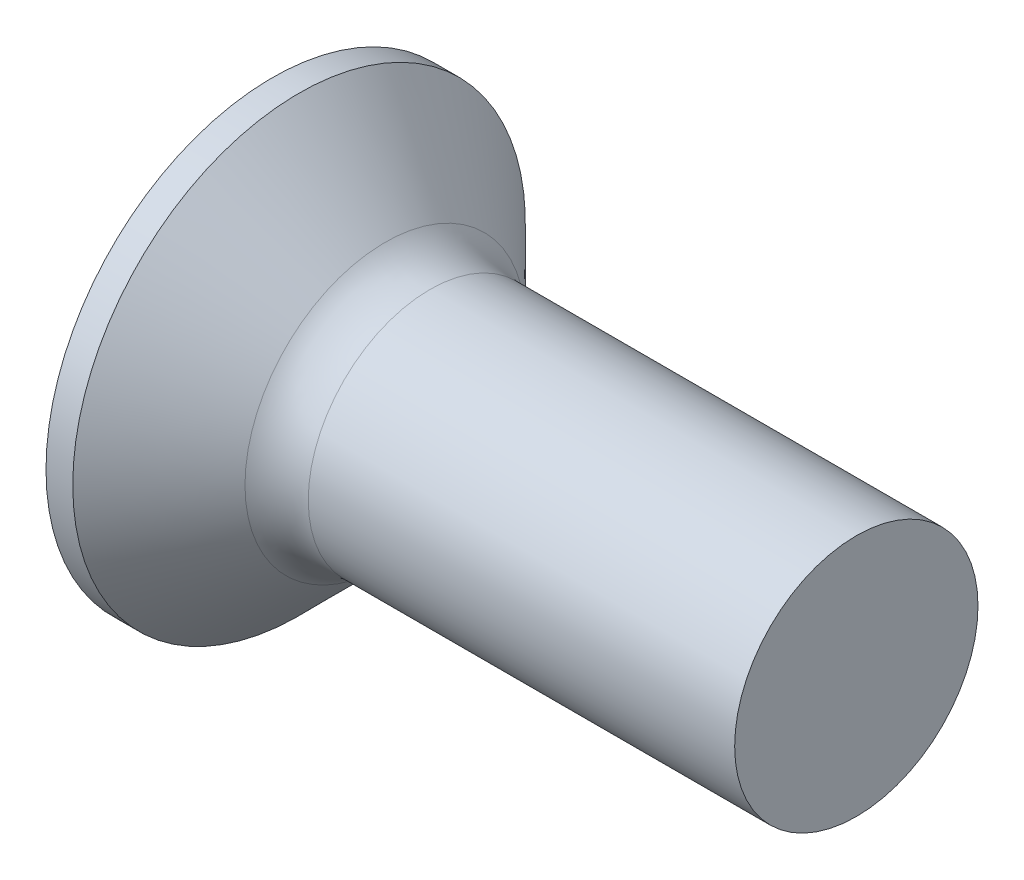
from build123d import *

# Parameters (mm, degrees)
FILLET1_R    = 1.3
RECPAT_COUNT = 2
RECPAT_ANGLE = 90


with BuildPart() as part:
    # BodySke → Base-Revolve (revolve)
    with BuildSketch(Plane.XY, mode=Mode.PRIVATE) as base_revolve_sk:
        Polygon((0, 0), (0, 4.65), (0.55, 4.65), (2.7, 2.5), (12, 2.5), (12, 0), align=None)
    revolve(base_revolve_sk.sketch.rotate(Axis((-6.35, 0, 0), (1, 0, 0)), 90), axis=Axis((-6.35, 0, 0), (1, 0, 0)))

    # Fillet1
    fillet1_edges = [part.edges().sort_by_distance(p)[0] for p in [
        (2.7, 0, -2.5),
    ]]
    fillet(fillet1_edges, radius=FILLET1_R)

    # Sketch3 → Recess section 0
    with BuildSketch(Plane.ZY):
        with BuildLine():
            Line((-0.515, 2.45), (0.515, 2.45))
            Line((0.515, 2.45), (0.515, -2.45))
            Line((0.515, -2.45), (-0.515, -2.45))
            Line((-0.515, -2.45), (-0.515, 2.45))
        make_face()
    # Sketch4 → Recess section 1
    with BuildSketch(Plane.ZY.offset(-3.05)):
        with BuildLine():
            Line((-0.515, 0.929326148), (0.515, 0.929326148))
            Line((0.515, 0.929326148), (0.515, -0.929326148))
            Line((0.515, -0.929326148), (-0.515, -0.929326148))
            Line((-0.515, -0.929326148), (-0.515, 0.929326148))
        make_face()
    recess = loft(mode=Mode.SUBTRACT)

    # RecPat: Recess ×2 about axis
    recpat_axis = Axis((0, 0, 0), (1, 0, 0))
    for i in range(1, RECPAT_COUNT):
        add(recess.rotate(recpat_axis, i * RECPAT_ANGLE / (RECPAT_COUNT - 1)), mode=Mode.SUBTRACT)

    # RecCorSke → RecessCore (revolve, cut)
    with BuildSketch(Plane.XY, mode=Mode.PRIVATE) as recesscore_sk:
        Polygon((0, 0), (0, 1.064276776), (3.05, 0.851), (3.326506661, 0), align=None)
    revolve(recesscore_sk.sketch.rotate(Axis((-3.175, 0, 0), (1, 0, 0)), 90), axis=Axis((-3.175, 0, 0), (1, 0, 0)), mode=Mode.SUBTRACT)


solid = part.part
